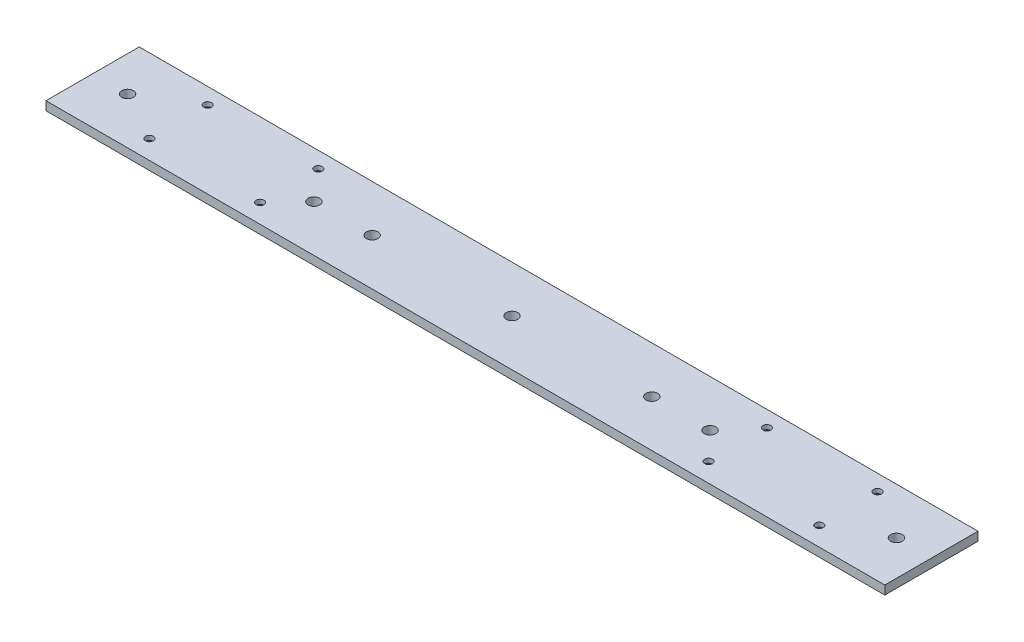
from build123d import *

# Parameters (mm, degrees)
SKETCH1_W                                     = 457.2
SKETCH1_H                                     = 50.8
BOSS_EXTRUDE1_DEPTH                           = 4.7625
SKETCH2_R                                     = 3.175
CUT_EXTRUDE1_DEPTH                            = 244.602
SKETCH3_R                                     = 3.175
CUT_EXTRUDE2_DEPTH                            = 244.602
SKETCH4_R                                     = 3.175
CUT_EXTRUDE3_DEPTH                            = 25.4
CSK_FOR_8_FLAT_HEAD_MACHINE_SCREW1_AT_2_COUNT = 2
CSK_FOR_8_FLAT_HEAD_MACHINE_SCREW1_AT_2_PITCH = 31.75
CSK_FOR_8_FLAT_HEAD_MACHINE_SCREW1_AT_3_COUNT = 2
CSK_FOR_8_FLAT_HEAD_MACHINE_SCREW1_AT_3_PITCH = 68.170141008
CSK_FOR_8_FLAT_HEAD_MACHINE_SCREW1_AT_4_COUNT = 2
CSK_FOR_8_FLAT_HEAD_MACHINE_SCREW1_AT_4_PITCH = 60.325
CSK_FOR_8_FLAT_HEAD_MACHINE_SCREW1_AT_5_COUNT = 2
CSK_FOR_8_FLAT_HEAD_MACHINE_SCREW1_AT_5_PITCH = 304.8
CSK_FOR_8_FLAT_HEAD_MACHINE_SCREW1_AT_6_COUNT = 2
CSK_FOR_8_FLAT_HEAD_MACHINE_SCREW1_AT_6_PITCH = 306.449184205
CSK_FOR_8_FLAT_HEAD_MACHINE_SCREW1_AT_7_COUNT = 2
CSK_FOR_8_FLAT_HEAD_MACHINE_SCREW1_AT_7_PITCH = 366.502835085
CSK_FOR_8_FLAT_HEAD_MACHINE_SCREW1_AT_8_COUNT = 2
CSK_FOR_8_FLAT_HEAD_MACHINE_SCREW1_AT_8_PITCH = 365.125


with BuildPart() as part:
    # Sketch1 → Boss-Extrude1 (new body)
    with BuildSketch(Plane(origin=(0, 0, 0), x_dir=(1, 0, 0), z_dir=(0, 1, 0))):
        with Locations((228.6, 25.4)):
            Rectangle(SKETCH1_W, SKETCH1_H)
    extrude(amount=BOSS_EXTRUDE1_DEPTH)

    # Sketch2 → Cut-Extrude1 (cut)
    with BuildSketch(Plane(origin=(0, 4.7625, 0), x_dir=(1, 0, 0), z_dir=(0, 1, 0))):
        with Locations(Location((19.05, 25.4, 0), (0, 0, 270))):
            Circle(SKETCH2_R)
        with Locations(Location((438.15, 25.4, 0), (0, 0, 270))):
            Circle(SKETCH2_R)
    extrude(amount=-CUT_EXTRUDE1_DEPTH, mode=Mode.SUBTRACT)

    # Sketch3 → Cut-Extrude2 (cut)
    with BuildSketch(Plane(origin=(0, 4.7625, 0), x_dir=(1, 0, 0), z_dir=(0, 1, 0))):
        with Locations(Location((152.4, 25.4, 0), (0, 0, 270))):
            Circle(SKETCH3_R)
        with Locations(Location((304.8, 25.4, 0), (0, 0, 270))):
            Circle(SKETCH3_R)
        with Locations(Location((228.6, 25.4, 0), (0, 0, 270))):
            Circle(SKETCH3_R)
    extrude(amount=-CUT_EXTRUDE2_DEPTH, mode=Mode.SUBTRACT)

    # Sketch4 → Cut-Extrude3 (cut)
    with BuildSketch(Plane(origin=(0, 4.7625, 0), x_dir=(1, 0, 0), z_dir=(0, 1, 0))):
        with Locations(Location((120.65, 25.4, 0), (0, 0, 270))):
            Circle(SKETCH4_R)
        with Locations(Location((336.55, 25.4, 0), (0, 0, 270))):
            Circle(SKETCH4_R)
    extrude(amount=-CUT_EXTRUDE3_DEPTH, mode=Mode.SUBTRACT)

    # Sketch5 → CSK for #8 Flat Head Machine Screw1 (revolve, cut)
    with BuildSketch(Plane(origin=(46.0375, 0, -42.06875), x_dir=(0, 0, -1), z_dir=(1, 0, 0))):
        Polygon((0, 0), (0, 4.7625), (2.15265, 4.7625), (2.15265, 2.3740728), (4.2164, 0), align=None)
    csk_for_8_flat_head_machine_screw1 = revolve(axis=Axis((46.0375, -6.35, -42.06875), (0, 1, 0)), mode=Mode.SUBTRACT)

    # CSK for #8 Flat Head Machine Screw1 at 2: CSK for #8 Flat Head Machine Screw1 ×2
    with Locations(*[(0, 0, i * CSK_FOR_8_FLAT_HEAD_MACHINE_SCREW1_AT_2_PITCH) for i in range(1, CSK_FOR_8_FLAT_HEAD_MACHINE_SCREW1_AT_2_COUNT)]):
        add(csk_for_8_flat_head_machine_screw1, mode=Mode.SUBTRACT)

    # CSK for #8 Flat Head Machine Screw1 at 3: CSK for #8 Flat Head Machine Screw1 ×2
    with Locations(*[Vector(0.8849182223819825, 0, 0.4657464328326221) * (i * CSK_FOR_8_FLAT_HEAD_MACHINE_SCREW1_AT_3_PITCH) for i in range(1, CSK_FOR_8_FLAT_HEAD_MACHINE_SCREW1_AT_3_COUNT)]):
        add(csk_for_8_flat_head_machine_screw1, mode=Mode.SUBTRACT)

    # CSK for #8 Flat Head Machine Screw1 at 4: CSK for #8 Flat Head Machine Screw1 ×2
    with Locations(*[(i * CSK_FOR_8_FLAT_HEAD_MACHINE_SCREW1_AT_4_PITCH, 0, 0) for i in range(1, CSK_FOR_8_FLAT_HEAD_MACHINE_SCREW1_AT_4_COUNT)]):
        add(csk_for_8_flat_head_machine_screw1, mode=Mode.SUBTRACT)

    # CSK for #8 Flat Head Machine Screw1 at 5: CSK for #8 Flat Head Machine Screw1 ×2
    with Locations(*[(i * CSK_FOR_8_FLAT_HEAD_MACHINE_SCREW1_AT_5_PITCH, 0, 0) for i in range(1, CSK_FOR_8_FLAT_HEAD_MACHINE_SCREW1_AT_5_COUNT)]):
        add(csk_for_8_flat_head_machine_screw1, mode=Mode.SUBTRACT)

    # CSK for #8 Flat Head Machine Screw1 at 6: CSK for #8 Flat Head Machine Screw1 ×2
    with Locations(*[Vector(0.9946184088907778, 0, 0.103606084259456) * (i * CSK_FOR_8_FLAT_HEAD_MACHINE_SCREW1_AT_6_PITCH) for i in range(1, CSK_FOR_8_FLAT_HEAD_MACHINE_SCREW1_AT_6_COUNT)]):
        add(csk_for_8_flat_head_machine_screw1, mode=Mode.SUBTRACT)

    # CSK for #8 Flat Head Machine Screw1 at 7: CSK for #8 Flat Head Machine Screw1 ×2
    with Locations(*[Vector(0.996240588195683, 0, 0.086629616364842) * (i * CSK_FOR_8_FLAT_HEAD_MACHINE_SCREW1_AT_7_PITCH) for i in range(1, CSK_FOR_8_FLAT_HEAD_MACHINE_SCREW1_AT_7_COUNT)]):
        add(csk_for_8_flat_head_machine_screw1, mode=Mode.SUBTRACT)

    # CSK for #8 Flat Head Machine Screw1 at 8: CSK for #8 Flat Head Machine Screw1 ×2
    with Locations(*[(i * CSK_FOR_8_FLAT_HEAD_MACHINE_SCREW1_AT_8_PITCH, 0, 0) for i in range(1, CSK_FOR_8_FLAT_HEAD_MACHINE_SCREW1_AT_8_COUNT)]):
        add(csk_for_8_flat_head_machine_screw1, mode=Mode.SUBTRACT)


solid = part.part
